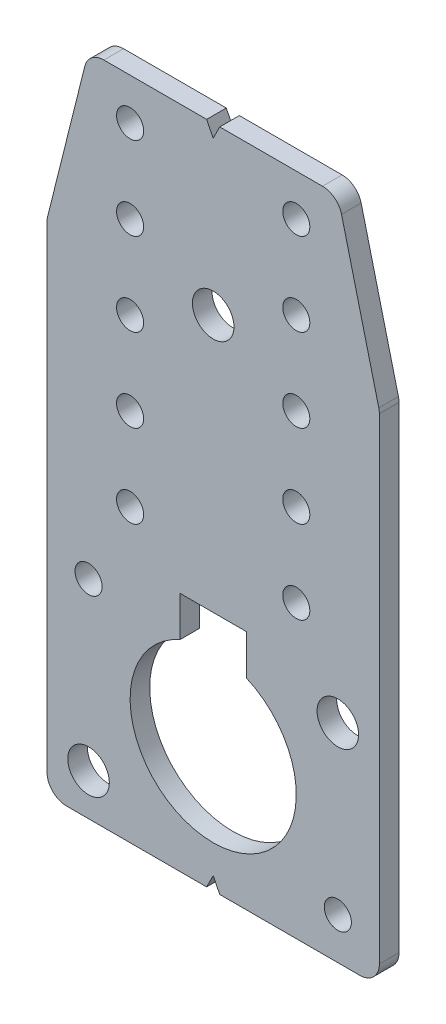
from build123d import *

# Parameters (mm, degrees)
SKETCH1_R           = 12.7
SKETCH1_R_2         = 3.175
SKETCH1_R_3         = 2.07
BOSS_EXTRUDE1_DEPTH = 1.5
FILLET1_R           = 3.000000096
CUT_EXTRUDE1_START  = -3
CUT_EXTRUDE1_DEPTH  = 3


with BuildPart() as part:
    # Sketch1 → Boss-Extrude1 (new, symmetric)
    with BuildSketch(Plane.XY):
        Polygon((-19.05, 82.55), (19.05, 82.55), (25.4, 57.15), (25.4, -19.05), (-25.4, -19.05), (-25.4, 57.15), align=None)
        Circle(SKETCH1_R, mode=Mode.SUBTRACT)
        with Locations((-19.05, -12.7)):
            Circle(SKETCH1_R_2, mode=Mode.SUBTRACT)
        with Locations((19.05, 12.7)):
            Circle(SKETCH1_R_2, mode=Mode.SUBTRACT)
        with Locations((-19.05, 12.7)):
            Circle(SKETCH1_R_3, mode=Mode.SUBTRACT)
        with Locations((19.05, -12.7)):
            Circle(SKETCH1_R_3, mode=Mode.SUBTRACT)
        with Locations((0, 57.15)):
            Circle(SKETCH1_R_2, mode=Mode.SUBTRACT)
        with Locations((12.7, 25.4)):
            Circle(SKETCH1_R_3, mode=Mode.SUBTRACT)
        with Locations((12.7, 38.1)):
            Circle(SKETCH1_R_3, mode=Mode.SUBTRACT)
        with Locations((12.7, 50.8)):
            Circle(SKETCH1_R_3, mode=Mode.SUBTRACT)
        with Locations((12.7, 63.5)):
            Circle(SKETCH1_R_3, mode=Mode.SUBTRACT)
        with Locations((12.7, 76.2)):
            Circle(SKETCH1_R_3, mode=Mode.SUBTRACT)
        with Locations(Location((-12.7, 25.4, 0), (0, 0, 180))):
            Circle(SKETCH1_R_3, mode=Mode.SUBTRACT)
        with Locations(Location((-12.7, 38.1, 0), (0, 0, 180))):
            Circle(SKETCH1_R_3, mode=Mode.SUBTRACT)
        with Locations(Location((-12.7, 50.8, 0), (0, 0, 180))):
            Circle(SKETCH1_R_3, mode=Mode.SUBTRACT)
        with Locations(Location((-12.7, 63.5, 0), (0, 0, 180))):
            Circle(SKETCH1_R_3, mode=Mode.SUBTRACT)
        with Locations(Location((-12.7, 76.2, 0), (0, 0, 180))):
            Circle(SKETCH1_R_3, mode=Mode.SUBTRACT)
    extrude(amount=BOSS_EXTRUDE1_DEPTH, both=True)

    # Fillet1
    fillet1_edges = [part.edges().sort_by_distance(p)[0] for p in [
        (-19.05, 82.55, 0),
        (19.05, 82.55, 0),
        (25.4, 57.15, 0),
        (25.4, -19.05, 0),
        (-25.4, -19.05, 0),
        (-25.4, 57.15, 0),
    ]]
    fillet(fillet1_edges, radius=FILLET1_R)

    # Sketch2 → Cut-Extrude1 (cut)
    with BuildSketch(Plane.XY.offset(1.5).offset(CUT_EXTRUDE1_START)):
        with BuildLine():
            Line((5.08, 17.78), (-5.08, 17.78))
            Line((-5.08, 17.78), (-5.08, 11.639742265))
            ThreePointArc((-5.08, 11.639742265), (0, 12.7), (5.08, 11.639742265))
            Line((5.08, 11.639742265), (5.08, 17.78))
        make_face()
        Polygon((0, -17.05), (-1, -19.05), (1, -19.05), align=None)
        Polygon((1, 82.55), (-1, 82.55), (0, 80.55), align=None)
    extrude(amount=CUT_EXTRUDE1_DEPTH, mode=Mode.SUBTRACT)


solid = part.part
